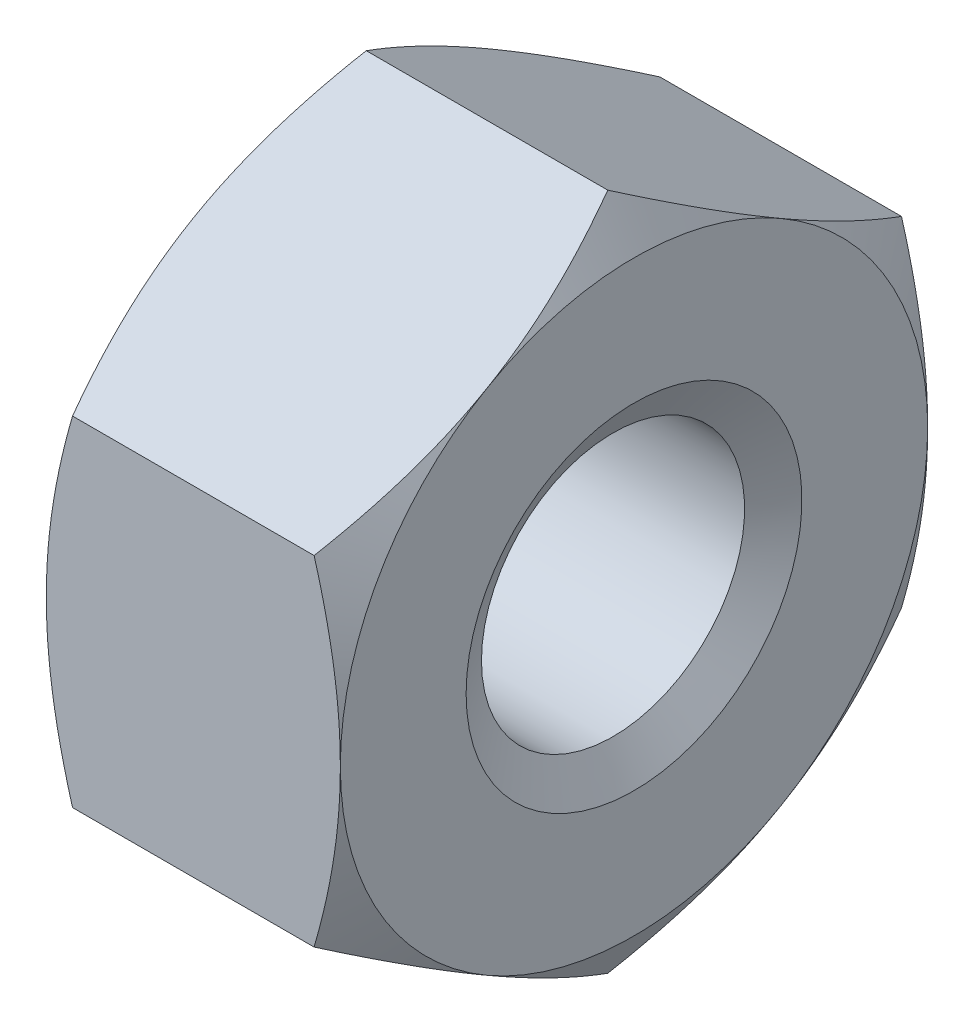
from build123d import *

# Parameters (mm, degrees)
BODY_DEPTH     = 5.5626
THREAD_D       = 4.9784
CHAMFER2_SIZE  = 0.687407664
CHAMFER2_SIZE2 = 0.396875
CHAMFER3_SIZE  = 0.687407664
CHAMFER3_SIZE2 = 0.396875


with BuildPart() as part:
    # Sketch1 → Body (new body)
    with BuildSketch(Plane.YZ):
        Polygon((-6.415804866, 0), (-3.207902433, 5.55625), (3.207902433, 5.55625), (6.415804866, 0), (3.207902433, -5.55625), (-3.207902433, -5.55625), align=None)
    extrude(amount=BODY_DEPTH)

    # Sketch2 → Chamfer1 (revolve, cut)
    with BuildSketch(Plane.XY):
        Polygon((0, 5.55625), (0.496264233, 6.415804866), (0, 6.415804866), align=None)
        Polygon((5.5626, 5.55625), (5.5626, 6.415804866), (5.066335767, 6.415804866), align=None)
    revolve(axis=Axis((-1.11252, 0, 0), (1, 0, 0)), mode=Mode.SUBTRACT)

    # Thread (through all)
    with Locations(Plane(origin=(5.5626, 0, 0), x_dir=(0, 0, -1), z_dir=(1, 0, 0))):
        with Locations((0, 0)):
            Hole(THREAD_D / 2)

    # Chamfer2
    chamfer2_edges = [part.edges().sort_by_distance(p)[0] for p in [
        (5.5626, 0, -2.4892),
    ]]
    chamfer2_side = [part.faces().sort_by_distance(p)[0] for p in [
        (5.5626, -5.399095518, -9.9e-08),
    ]]
    chamfer(chamfer2_edges, length=CHAMFER2_SIZE, length2=CHAMFER2_SIZE2, reference=chamfer2_side[0])

    # Chamfer3
    chamfer3_edges = [part.edges().sort_by_distance(p)[0] for p in [
        (0, 0, -2.4892),
    ]]
    chamfer3_side = [part.faces().sort_by_distance(p)[0] for p in [
        (0, -5.399095518, -9.9e-08),
    ]]
    chamfer(chamfer3_edges, length=CHAMFER3_SIZE, length2=CHAMFER3_SIZE2, reference=chamfer3_side[0])


solid = part.part
